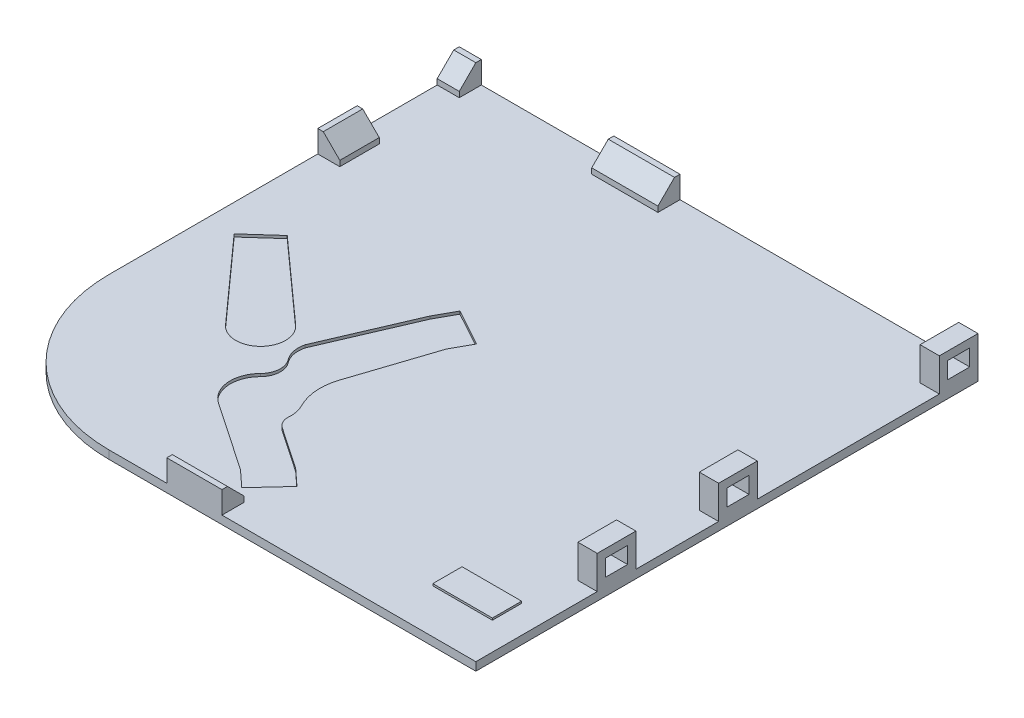
from build123d import *

# Parameters (mm, degrees)
EXTRUDE_1_DEPTH     = 1.5
SKETCH_3_W          = 7
SKETCH_3_H          = 6
SKETCH_3_W_2        = 4
SKETCH_3_H_2        = 3
EXTRUDE_3_DEPTH     = 3
SKETCH_4_W          = 7
SKETCH_4_H          = 6
EXTRUDE_4_DEPTH     = 0.5
SKETCH_5_W          = 4
SKETCH_5_H          = 4
SKETCH_5_W_2        = 12
SKETCH_5_H_2        = 7.145089785
SKETCH_5_W_3        = 10
EXTRUDE_5_DEPTH     = 4
CHAMFER_1_SIZE      = 3
CUT_EXTRUDE_2_DEPTH = 0.5
SKETCH_8_W          = 10.8
SKETCH_8_H          = 5.3
EXTRUDE_6_DEPTH     = 1.85


with BuildPart() as part:
    # Эскиз1 → Бобышка-Вытянуть1 (new body)
    with BuildSketch(Plane(origin=(0, 0, 0), x_dir=(1, 0, 0), z_dir=(0, 1, 0))):
        with BuildLine():
            Line((-27.5, 63.5), (-27.5, 0))
            ThreePointArc((-27.5, 0), (-19.445436483, -19.445436483), (0, -27.5))
            Line((0, -27.5), (66.5, -27.5))
            Line((66.5, -27.5), (66.5, 63.5))
            Line((66.5, 63.5), (-27.5, 63.5))
        make_face()
    extrude(amount=EXTRUDE_1_DEPTH)

    # Эскиз3 → Бобышка-Вытянуть3 (add)
    # profile 1 of 3: a face of its own
    with BuildSketch(Plane(origin=(66.5, 0, 0), x_dir=(0, 0, -1), z_dir=(1, 0, 0))):
        with Locations((-2, 4.5)):
            Rectangle(SKETCH_3_W, SKETCH_3_H)
        with Locations((-2, 4.5)):
            Rectangle(SKETCH_3_W_2, SKETCH_3_H_2, mode=Mode.SUBTRACT)
    # profile 2 of 3: a face of its own
    with BuildSketch(Plane(origin=(66.5, 0, 0), x_dir=(0, 0, -1), z_dir=(1, 0, 0))):
        with Locations((60, 4.5)):
            Rectangle(SKETCH_3_W, SKETCH_3_H)
        with Locations((60, 4.5)):
            Rectangle(SKETCH_3_W_2, SKETCH_3_H_2, mode=Mode.SUBTRACT)
    # profile 3 of 3: a face of its own
    with BuildSketch(Plane(origin=(66.5, 0, 0), x_dir=(0, 0, -1), z_dir=(1, 0, 0))):
        with Locations((20, 4.5)):
            Rectangle(SKETCH_3_W, SKETCH_3_H)
        with Locations((20, 4.5)):
            Rectangle(SKETCH_3_W_2, SKETCH_3_H_2, mode=Mode.SUBTRACT)
    extrude(amount=-EXTRUDE_3_DEPTH)

    # Эскиз4 → Бобышка-Вытянуть4 (add)
    with BuildSketch(Plane.ZY.offset(-63.5)):
        with Locations((-60, 4.5)):
            Rectangle(SKETCH_4_W, SKETCH_4_H)
        with Locations((-20, 4.5)):
            Rectangle(SKETCH_4_W, SKETCH_4_H)
        with Locations((2, 4.5)):
            Rectangle(SKETCH_4_W, SKETCH_4_H)
    extrude(amount=EXTRUDE_4_DEPTH)

    # Эскиз5 → Бобышка-Вытянуть5 (add)
    with BuildSketch(Plane(origin=(0, 1.5, 0), x_dir=(1, 0, 0), z_dir=(0, 1, 0))):
        with Locations((-25.5, 61.5)):
            Rectangle(SKETCH_5_W, SKETCH_5_H)
        with Locations((6.5, 61.5)):
            Rectangle(SKETCH_5_W_2, SKETCH_5_H)
        with Locations((-25.5, 41.427455108)):
            Rectangle(SKETCH_5_W, SKETCH_5_H_2)
        with Locations((15.5, -25.5)):
            Rectangle(SKETCH_5_W_3, SKETCH_5_H)
    extrude(amount=EXTRUDE_5_DEPTH)

    # Фаска1
    chamfer_1_edges = [part.edges().sort_by_distance(p)[0] for p in [
        (6.5, 5.5, -59.5),
        (-25.5, 5.5, -59.5),
        (-23.5, 5.5, -41.427455107),
        (15.5, 5.5, 23.5),
    ]]
    chamfer(chamfer_1_edges, length=CHAMFER_1_SIZE)

    # Эскиз7 → Вырез-Вытянуть2 (cut)
    with BuildSketch(Plane(origin=(0, 1.5, 0), x_dir=(1, 0, 0), z_dir=(0, 1, 0))):
        with BuildLine():
            Line((-19.62312526, 14.49129531), (-22.541249894, 17.745613481))
            Line((-22.541249894, 17.745613481), (-17.469363806, 22.293538718))
            Line((-17.469363806, 22.293538718), (-14.49129531, 19.62312526))
            Line((-14.49129531, 19.62312526), (-2.655568985, 9.010111183))
            ThreePointArc((-2.655568985, 9.010111183), (-2.47780361, 2.47780361), (-9.010111183, 2.655568985))
            Line((-9.010111183, 2.655568985), (-19.62312526, 14.49129531))
        make_face()
        with BuildLine():
            Line((9.950995869, 4.304852328), (14.772590148, 18.914824353))
            Line((14.772590148, 18.914824353), (16.702744877, 22.418322994))
            Line((16.702744877, 22.418322994), (10.02542163, 26.097007748))
            Line((10.02542163, 26.097007748), (8.095266902, 22.593509107))
            Line((8.095266902, 22.593509107), (1.302167241, 6.782804644))
            ThreePointArc((1.302167241, 6.782804644), (1.249533327, 4.765531423), (2.083776147, 2.928087411))
            ThreePointArc((2.083776147, 2.928087411), (2.810034737, 0.519874571), (1.770696829, -1.770696829))
            ThreePointArc((1.770696829, -1.770696829), (0.184130493, -6.176714777), (2.567220604, -10.207976169))
            Line((2.567220604, -10.207976169), (15.04943055, -18.695310645))
            Line((15.04943055, -18.695310645), (17.989670533, -21.407318912))
            Line((17.989670533, -21.407318912), (22.788067369, -16.205108284))
            Line((22.788067369, -16.205108284), (19.847827385, -13.493100017))
            Line((19.847827385, -13.493100017), (12.232446688, -8.314987854))
            ThreePointArc((12.232446688, -8.314987854), (11.3870962, -7.335158785), (11.144915737, -6.063926675))
            ThreePointArc((11.144915737, -6.063926675), (11.047783222, -4.555489901), (10.543689128, -3.130461702))
            ThreePointArc((10.543689128, -3.130461702), (9.497003398, 0.527383324), (9.950995869, 4.304852328))
        make_face()
    extrude(amount=-CUT_EXTRUDE_2_DEPTH, mode=Mode.SUBTRACT)

    # Эскиз8 → Бобышка-Вытянуть6 (add)
    with BuildSketch(Plane(origin=(0, 0, 0), x_dir=(1, 0, 0), z_dir=(0, 1, 0))):
        with Locations((56.1, -16.85)):
            Rectangle(SKETCH_8_W, SKETCH_8_H)
    extrude(amount=EXTRUDE_6_DEPTH)


solid = part.part
